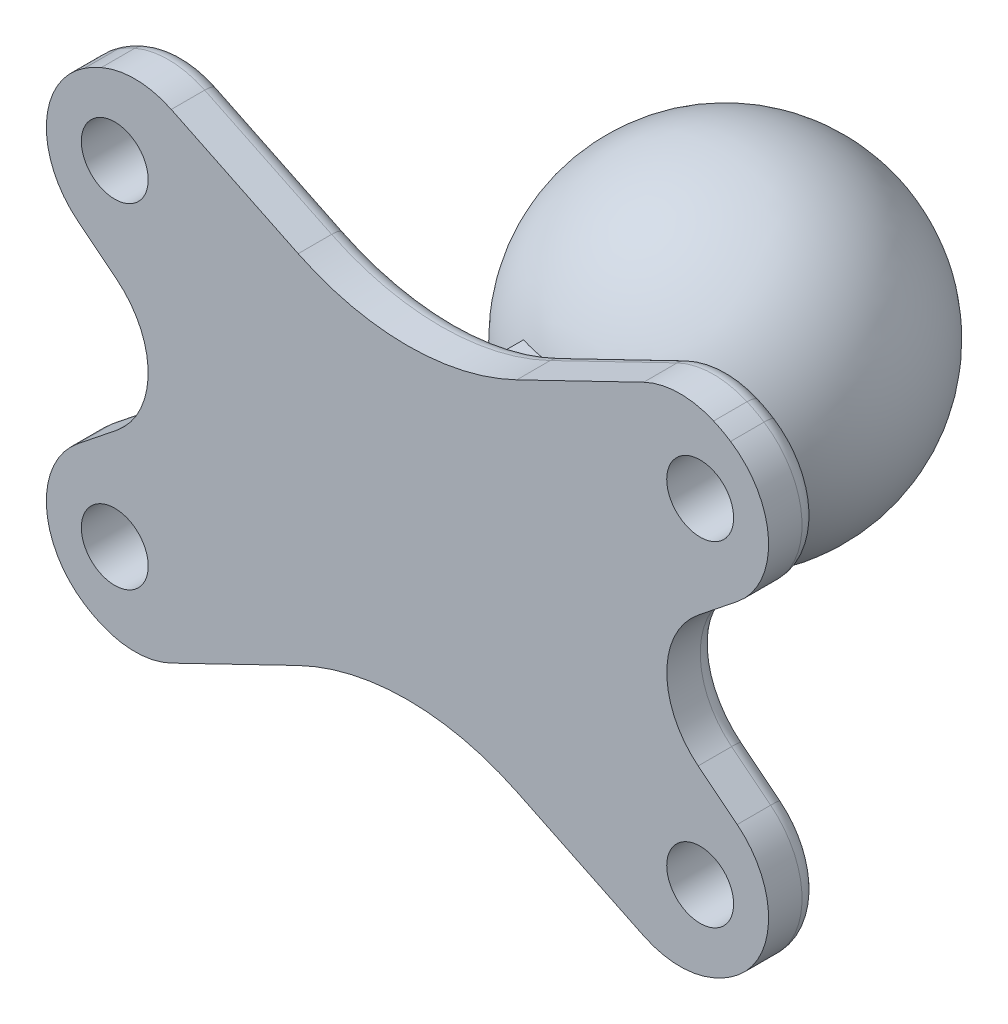
from build123d import *

# Parameters (mm, degrees)
SKETCH1_R           = 2
BOSS_EXTRUDE1_DEPTH = 3
FILLET1_R           = 1
SKETCH2_W           = 6
SKETCH2_H           = 6
BOSS_EXTRUDE2_DEPTH = 13
FILLET4_R           = 1


with BuildPart() as part:
    # Sketch1 → Boss-Extrude1 (new body)
    with BuildSketch(Plane(origin=(0, 0, -3), x_dir=(-1, 0, 0), z_dir=(0, 0, -1))):
        with BuildLine():
            Line((-22.078522838, 93.957303237), (-14.489191473, 97.629560349))
            ThreePointArc((-14.489191473, 97.629560349), (-7.955777551, 99.127171578), (-1.42236363, 97.629560349))
            Line((-1.42236363, 97.629560349), (6.166967735, 93.957303237))
            ThreePointArc((6.166967735, 93.957303237), (8.247667355, 93.459042522), (10.346147194, 93.876124065))
            ThreePointArc((10.346147194, 93.876124065), (10.86613185, 94.129321852), (11.363439854, 94.424580911))
            ThreePointArc((11.363439854, 94.424580911), (13.629470969, 98.370815693), (11.75890266, 102.519145498))
            Line((11.75890266, 102.519145498), (9.424652508, 104.386545619))
            ThreePointArc((9.424652508, 104.386545619), (7.548127746, 108.290889666), (9.424652508, 112.195233714))
            Line((9.424652508, 112.195233714), (11.75890266, 114.062633835))
            ThreePointArc((11.75890266, 114.062633835), (13.629470969, 118.21096364), (11.363439854, 122.157198422))
            ThreePointArc((11.363439854, 122.157198422), (10.86613185, 122.452457481), (10.346147194, 122.705655268))
            ThreePointArc((10.346147194, 122.705655268), (8.247667355, 123.122736811), (6.166967735, 122.624476095))
            Line((6.166967735, 122.624476095), (-1.42236363, 118.952218983))
            ThreePointArc((-1.42236363, 118.952218983), (-7.955777551, 117.454607754), (-14.489191473, 118.952218983))
            Line((-14.489191473, 118.952218983), (-22.078522838, 122.624476095))
            ThreePointArc((-22.078522838, 122.624476095), (-24.159222457, 123.122736811), (-26.257702296, 122.705655268))
            ThreePointArc((-26.257702296, 122.705655268), (-26.777686952, 122.452457481), (-27.274994956, 122.157198422))
            ThreePointArc((-27.274994956, 122.157198422), (-29.541026071, 118.21096364), (-27.670457762, 114.062633835))
            Line((-27.670457762, 114.062633835), (-25.33620761, 112.195233714))
            ThreePointArc((-25.33620761, 112.195233714), (-23.459682848, 108.290889666), (-25.33620761, 104.386545619))
            Line((-25.33620761, 104.386545619), (-27.670457762, 102.519145498))
            ThreePointArc((-27.670457762, 102.519145498), (-29.541026071, 98.370815693), (-27.274994956, 94.424580911))
            ThreePointArc((-27.274994956, 94.424580911), (-26.777686952, 94.129321852), (-26.257702296, 93.876124065))
            ThreePointArc((-26.257702296, 93.876124065), (-24.159222457, 93.459042522), (-22.078522838, 93.957303237))
        make_face()
        with Locations((-25.455777551, 118.290889666)):
            Circle(SKETCH1_R, mode=Mode.SUBTRACT)
        with Locations((9.544222449, 118.290889666)):
            Circle(SKETCH1_R, mode=Mode.SUBTRACT)
        with Locations((-25.455777551, 98.290889666)):
            Circle(SKETCH1_R, mode=Mode.SUBTRACT)
        with Locations((9.544222449, 98.290889666)):
            Circle(SKETCH1_R, mode=Mode.SUBTRACT)
    extrude(amount=BOSS_EXTRUDE1_DEPTH)

    # Fillet1
    fillet1_edges = [part.edges().sort_by_distance(p)[0] for p in [
        (18.283857155, 95.793431793, -6),
        (7.955777551, 99.127171578, -6),
    ]]
    fillet(fillet1_edges, radius=FILLET1_R)

    # Sketch2 → Boss-Extrude2 (add)
    with BuildSketch(Plane(origin=(0, 0, -6), x_dir=(-1, 0, 0), z_dir=(0, 0, -1))):
        with Locations((-7.955777551, 108.290889666)):
            Rectangle(SKETCH2_W, SKETCH2_H)
    extrude(amount=BOSS_EXTRUDE2_DEPTH)

    # Fillet4
    fillet4_edges = [part.edges().sort_by_distance(p)[0] for p in [
        (7.955777551, 105.290889666, -6),
        (10.955777551, 108.290889666, -6),
        (7.955777551, 111.290889666, -6),
        (4.955777551, 108.290889666, -6),
    ]]
    fillet(fillet4_edges, radius=FILLET4_R)

    # Sketch4 → Revolve2 (revolve)
    with BuildSketch(Plane(origin=(0, 108.290889666, 0), x_dir=(0, 0, -1), z_dir=(0, 1, 0))):
        with BuildLine():
            Line((12, -7.955777551), (32, -7.955777551))
            ThreePointArc((32, -7.955777551), (22, -17.955777551), (12, -7.955777551))
        make_face()
    revolve(axis=Axis((7.955777551, 108.290889666, -12), (0, 0, -1)))


solid = part.part
